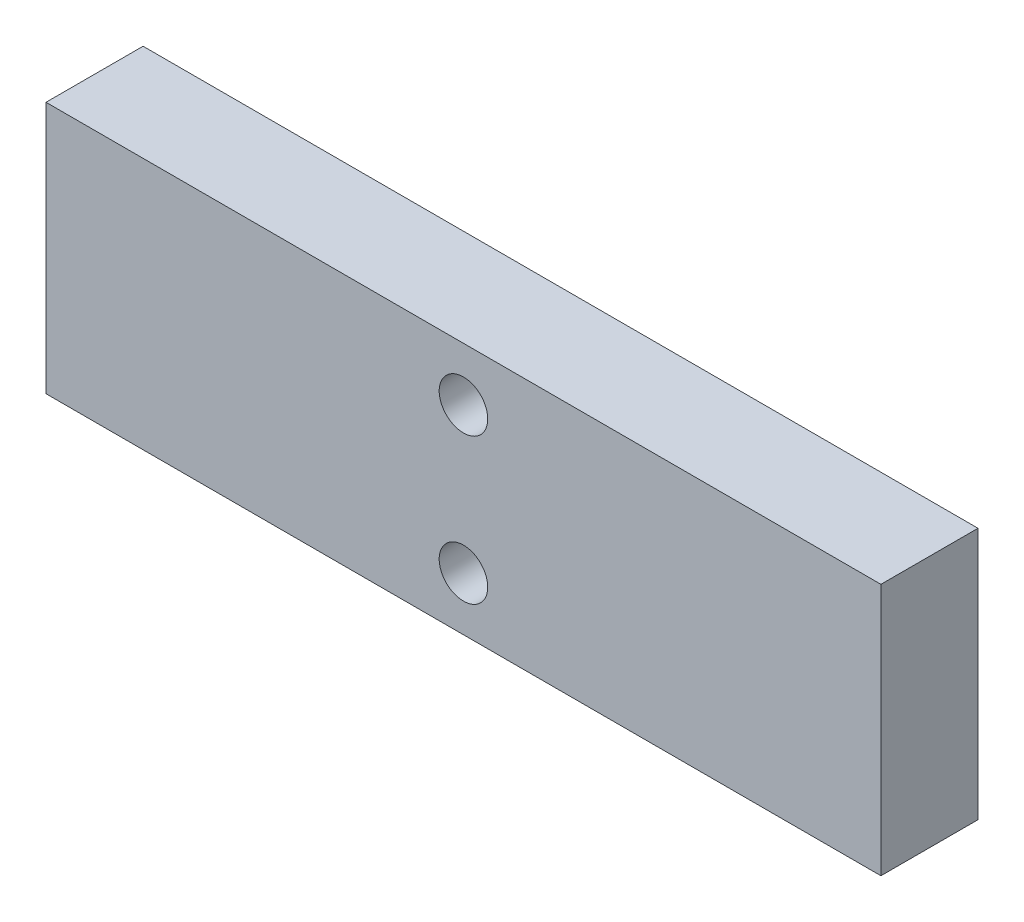
from build123d import *

# Parameters (mm, degrees)
SKETCH1_W           = 86
SKETCH1_H           = 26
SKETCH1_R           = 2.5
BOSS_EXTRUDE1_DEPTH = 10


with BuildPart() as part:
    # Sketch1 → Boss-Extrude1 (new body)
    with BuildSketch(Plane.XY):
        Rectangle(SKETCH1_W, SKETCH1_H)
        with Locations((0, 7.5)):
            Circle(SKETCH1_R, mode=Mode.SUBTRACT)
        with Locations((0, -7.5)):
            Circle(SKETCH1_R, mode=Mode.SUBTRACT)
    extrude(amount=BOSS_EXTRUDE1_DEPTH)


solid = part.part
